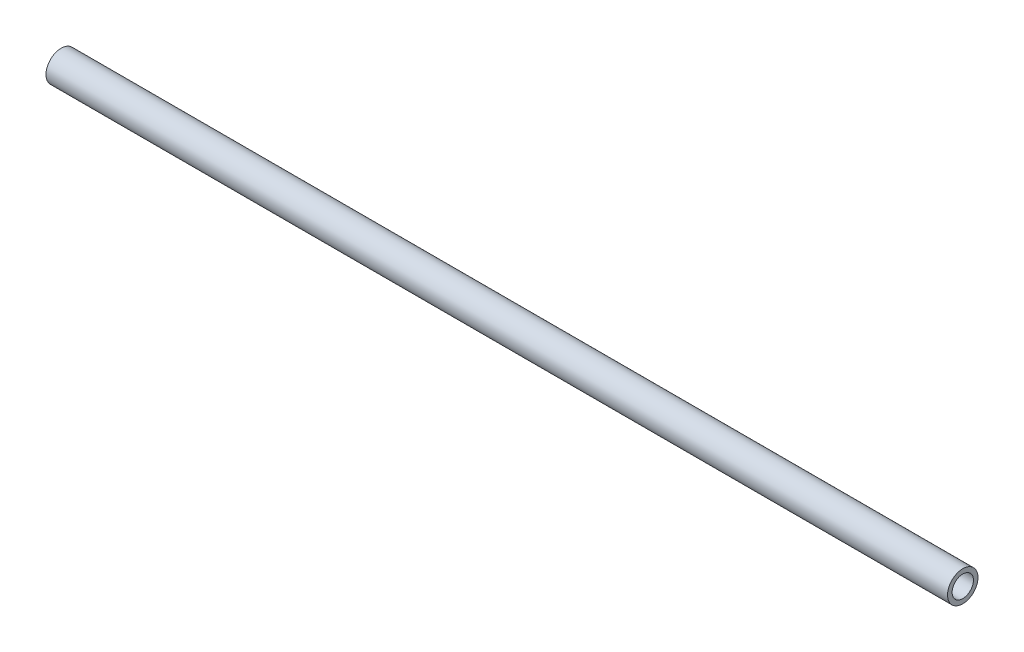
from build123d import *

# Parameters (mm, degrees)
SKETCH1_R           = 15.875
SKETCH1_R_2         = 11.1125
BOSS_EXTRUDE1_DEPTH = 939.8


with BuildPart() as part:
    # Sketch1 → Boss-Extrude1 (new body)
    with BuildSketch(Plane(origin=(0, 0, 0), x_dir=(0, 0, -1), z_dir=(1, 0, 0))):
        Circle(SKETCH1_R)
        Circle(SKETCH1_R_2, mode=Mode.SUBTRACT)
    extrude(amount=BOSS_EXTRUDE1_DEPTH)


solid = part.part
